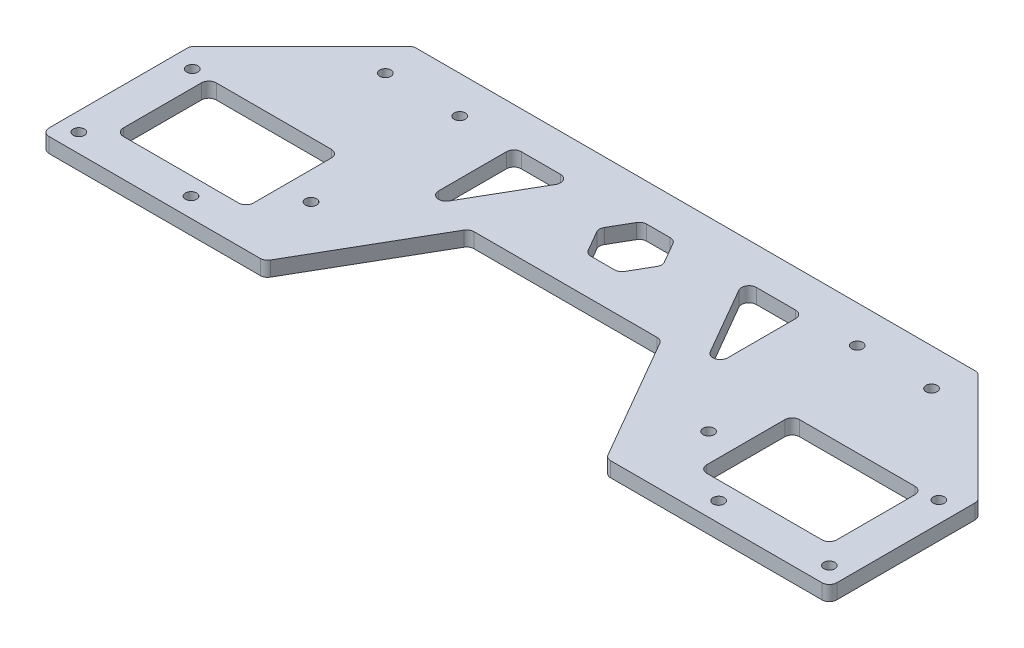
from build123d import *

# Parameters (mm, degrees)
EXTRUDE_1_DEPTH     = 4
SKETCH_2_W          = 35
SKETCH_2_H          = 25
CUT_EXTRUDE_1_DEPTH = 4
SKETCH_3_R          = 1.5
CUT_EXTRUDE_2_DEPTH = 4
CUT_EXTRUDE_3_DEPTH = 4
FILLET_1_R          = 2


with BuildPart() as part:
    # 草图1 → 凸台-拉伸1 (new body)
    with BuildSketch(Plane(origin=(0, 0, 0), x_dir=(1, 0, 0), z_dir=(0, 1, 0))):
        Polygon((0, 0), (51.585481157, 0), (71.792740578, -35), (131.792740578, -35), (131.792740578, 5), (101.792740578, 35), (-50.207259422, 35), (-80.207259422, 5), (-80.207259422, -35), (-20.207259422, -35), align=None)
    extrude(amount=EXTRUDE_1_DEPTH)

    # 草图2 → 切除-拉伸1 (cut)
    with BuildSketch(Plane(origin=(0, 4, 0), x_dir=(1, 0, 0), z_dir=(0, 1, 0))):
        with Locations((-52.707259422, -12.5)):
            Rectangle(SKETCH_2_W, SKETCH_2_H)
        with Locations((104.292740578, -12.5)):
            Rectangle(SKETCH_2_W, SKETCH_2_H)
    extrude(amount=-CUT_EXTRUDE_1_DEPTH, mode=Mode.SUBTRACT)

    # 草图3 → 切除-拉伸2 (cut)
    with BuildSketch(Plane(origin=(0, 4, 0), x_dir=(1, 0, 0), z_dir=(0, 1, 0))):
        with Locations(Location((-75.207259422, -30, 0), (0, 0, 270))):
            Circle(SKETCH_3_R)
        with Locations(Location((-45.207259422, -29.79681333, 0), (0, 0, 270))):
            Circle(SKETCH_3_R)
        with Locations(Location((-74.668557439, 0, 0), (0, 0, 270))):
            Circle(SKETCH_3_R)
        with Locations(Location((126.254038596, 0, 0), (0, 0, 90))):
            Circle(SKETCH_3_R)
        with Locations(Location((96.792740578, -29.79681333, 0), (0, 0, 90))):
            Circle(SKETCH_3_R)
        with Locations(Location((126.792740578, -30, 0), (0, 0, 90))):
            Circle(SKETCH_3_R)
        with Locations(Location((-27.707259422, -15, 0), (0, 0, 270))):
            Circle(SKETCH_3_R)
        with Locations(Location((-47.707259422, 25, 0), (0, 0, 270))):
            Circle(SKETCH_3_R)
        with Locations(Location((-27.707259422, 25, 0), (0, 0, 270))):
            Circle(SKETCH_3_R)
        with Locations(Location((79.292740578, -15, 0), (0, 0, 90))):
            Circle(SKETCH_3_R)
        with Locations(Location((99.292740578, 25, 0), (0, 0, 90))):
            Circle(SKETCH_3_R)
        with Locations(Location((79.292740578, 25, 0), (0, 0, 90))):
            Circle(SKETCH_3_R)
    extrude(amount=-CUT_EXTRUDE_2_DEPTH, mode=Mode.SUBTRACT)

    # 草图4 → 切除-拉伸3 (cut)
    with BuildSketch(Plane(origin=(0, 4, 0), x_dir=(1, 0, 0), z_dir=(0, 1, 0))):
        Polygon((34.452994616, 17.5), (30.122867597, 25), (21.462613559, 25), (17.132486541, 17.5), (21.462613559, 10), (30.122867597, 10), align=None)
        Polygon((48.698729811, 25), (64.698729811, 25), (64.698729811, -2.712812921), align=None)
        Polygon((-13.113248654, 25), (-13.113248654, -2.712812921), (2.886751346, 25), align=None)
    extrude(amount=-CUT_EXTRUDE_3_DEPTH, mode=Mode.SUBTRACT)

    # 圆角1
    fillet_1_edges = [part.edges().sort_by_distance(p)[0] for p in [
        (34.452994616, 2, -17.5),
        (30.122867597, 2, -10),
        (21.462613559, 2, -10),
        (17.132486541, 2, -17.5),
        (21.462613559, 2, -25),
        (30.122867597, 2, -25),
        (64.698729811, 2, -25),
        (64.698729811, 2, 2.712812921),
        (48.698729811, 2, -25),
        (-13.113248654, 2, -25),
        (2.886751346, 2, -25),
        (-13.113248654, 2, 2.712812921),
        (-20.207259422, 2, 35),
        (-80.207259422, 2, 35),
        (-80.207259422, 2, -5),
        (-50.207259422, 2, -35),
        (101.792740578, 2, -35),
        (131.792740578, 2, -5),
        (131.792740578, 2, 35),
        (71.792740578, 2, 35),
        (51.585481157, 2, 0),
        (0, 2, 0),
        (-70.207259422, 2, 25),
        (-70.207259422, 2, 0),
        (-35.207259422, 2, 0),
        (-35.207259422, 2, 25),
        (121.792740578, 2, 0),
        (121.792740578, 2, 25),
        (86.792740578, 2, 25),
        (86.792740578, 2, 0),
    ]]
    fillet(fillet_1_edges, radius=FILLET_1_R)


solid = part.part
